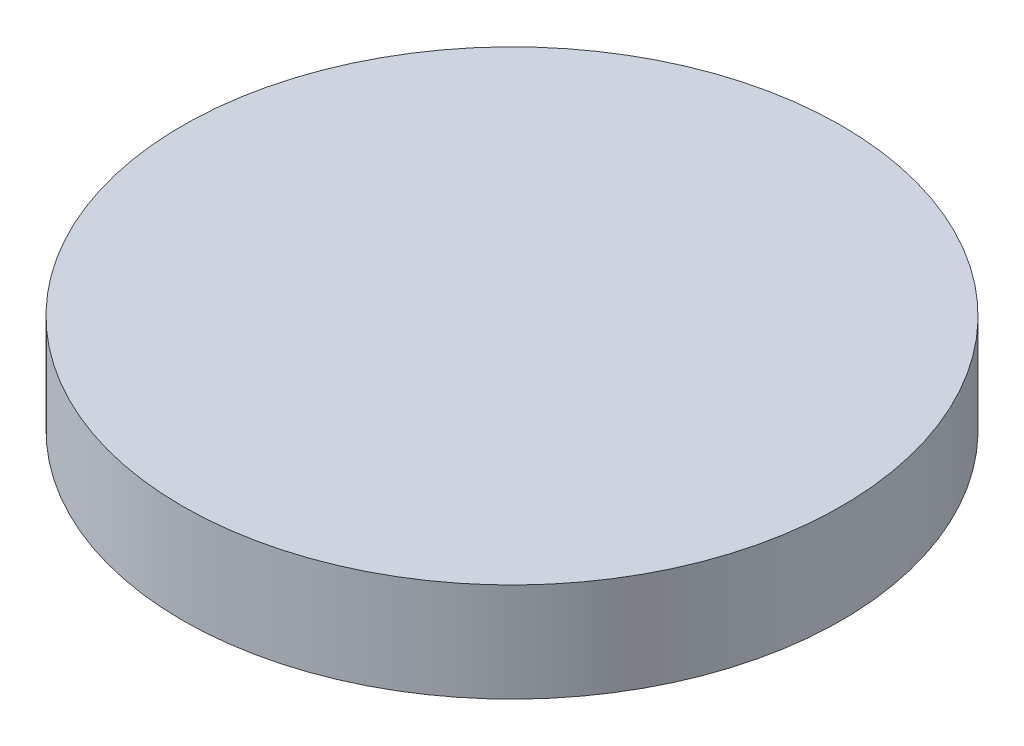
from build123d import *

# Parameters (mm, degrees)
SKETCH1_R           = 63.5
BOSS_EXTRUDE1_DEPTH = 19.05


with BuildPart() as part:
    # Sketch1 → Boss-Extrude1 (new body)
    with BuildSketch(Plane(origin=(0, 0, 0), x_dir=(1, 0, 0), z_dir=(0, 1, 0))):
        with Locations(Location((0, 0, 0), (0, 0, 90))):
            Circle(SKETCH1_R)
    extrude(amount=BOSS_EXTRUDE1_DEPTH)


solid = part.part
